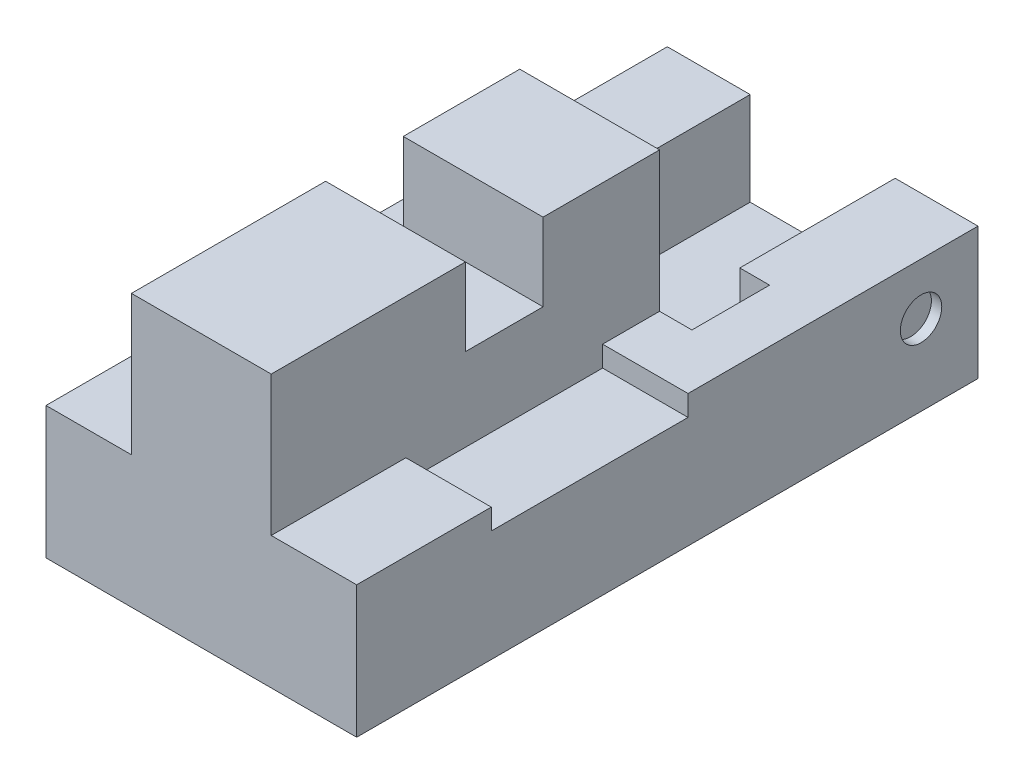
from build123d import *

# Parameters (mm, degrees)
BOSS_EXTRUDE1_DEPTH = 1.8
SKETCH2_W           = 6
SKETCH2_H           = 12
BOSS_EXTRUDE2_DEPTH = 0.75
SKETCH7_W           = 1.65
SKETCH7_H           = 3.8
CUT_EXTRUDE2_DEPTH  = 0.4
SKETCH9_R           = 0.4
CUT_EXTRUDE4_DEPTH  = 0.2
BOSS_EXTRUDE3_DEPTH = 2.7
SKETCH11_W          = 2.7
SKETCH11_H          = 1.5
CUT_EXTRUDE5_DEPTH  = 1.5


with BuildPart() as part:
    # Sketch1 → Boss-Extrude1 (new body)
    with BuildSketch(Plane(origin=(0, 0, 0), x_dir=(1, 0, 0), z_dir=(0, 1, 0))):
        Polygon((-1.4, 3), (-1.4, 0), (-1.975, 0), (-1.975, -1.5), (1.975, -1.5), (1.975, 0), (1.4, 0), (1.4, 3), (3, 3), (3, -9), (-3, -9), (-3, 3), align=None)
    extrude(amount=BOSS_EXTRUDE1_DEPTH)

    # Sketch2 → Boss-Extrude2 (add)
    with BuildSketch(Plane.XZ):
        with Locations((0, 3)):
            Rectangle(SKETCH2_W, SKETCH2_H)
    extrude(amount=BOSS_EXTRUDE2_DEPTH)

    # Sketch7 → Cut-Extrude2 (cut)
    with BuildSketch(Plane(origin=(0, 1.8, 0), x_dir=(1, 0, 0), z_dir=(0, 1, 0))):
        with Locations((-2.175, -4.5)):
            Rectangle(SKETCH7_W, SKETCH7_H)
        with Locations((2.175, -4.5)):
            Rectangle(SKETCH7_W, SKETCH7_H)
    extrude(amount=-CUT_EXTRUDE2_DEPTH, mode=Mode.SUBTRACT)

    # Sketch9 → Cut-Extrude4 (cut)
    with BuildSketch(Plane(origin=(3, 0, 0), x_dir=(0, 0, -1), z_dir=(1, 0, 0))):
        with Locations((1.9, 0.8)):
            Circle(SKETCH9_R)
    cut_extrude4 = extrude(amount=-CUT_EXTRUDE4_DEPTH, mode=Mode.SUBTRACT)

    # Mirror1: Cut-Extrude4 across plane
    add(cut_extrude4.mirror(Plane(origin=(0, 0, 0), x_dir=(0, 0, 1), z_dir=(1, 0, 0))), mode=Mode.SUBTRACT)

    # Sketch10 → Boss-Extrude3 (add)
    with BuildSketch(Plane(origin=(0, 1.8, 0), x_dir=(1, 0, 0), z_dir=(0, 1, 0))):
        Polygon((-1.35, -6.4), (-1.35, -9), (1.35, -9), (1.35, -6.4), (1.35, -2.6), (1.35, -1.5), (-1.35, -1.5), (-1.35, -2.6), align=None)
    extrude(amount=BOSS_EXTRUDE3_DEPTH)

    # Sketch11 → Cut-Extrude5 (cut)
    with BuildSketch(Plane(origin=(0, 4.5, 0), x_dir=(1, 0, 0), z_dir=(0, 1, 0))):
        with Locations((0, -4.5)):
            Rectangle(SKETCH11_W, SKETCH11_H)
    extrude(amount=-CUT_EXTRUDE5_DEPTH, mode=Mode.SUBTRACT)


solid = part.part
